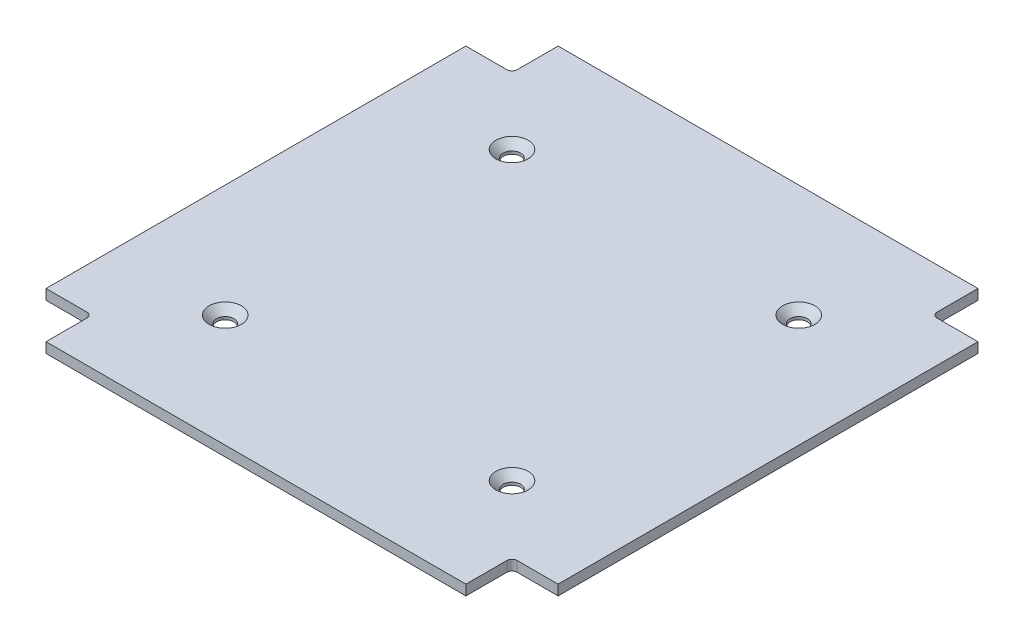
from build123d import *

# Parameters (mm, degrees)
SKETCH1_W                                      = 100
SKETCH1_H                                      = 100
BASE_EXTRUSION_DEPTH                           = 2
SKETCH2_W                                      = 9
SKETCH2_H                                      = 9
CORNER_CUTOUTS_DEPTH                           = 71.738956735
CSK_FOR_M3_FLAT_HEAD_MACHINE_SCREW2_AT_2_COUNT = 2
CSK_FOR_M3_FLAT_HEAD_MACHINE_SCREW2_AT_2_PITCH = 56
CSK_FOR_M3_FLAT_HEAD_MACHINE_SCREW2_AT_3_COUNT = 2
CSK_FOR_M3_FLAT_HEAD_MACHINE_SCREW2_AT_3_PITCH = 79.195959493
CSK_FOR_M3_FLAT_HEAD_MACHINE_SCREW2_AT_4_COUNT = 2
CSK_FOR_M3_FLAT_HEAD_MACHINE_SCREW2_AT_4_PITCH = 56
FILLET_FOR_RAILS_R                             = 1


with BuildPart() as part:
    # Sketch1 → Base Extrusion (new body)
    with BuildSketch(Plane(origin=(0, 0, 0), x_dir=(1, 0, 0), z_dir=(0, 1, 0))):
        Rectangle(SKETCH1_W, SKETCH1_H)
    extrude(amount=BASE_EXTRUSION_DEPTH)

    # Sketch2 → Corner Cutouts (cut, through all)
    with BuildSketch(Plane(origin=(0, 2, 0), x_dir=(1, 0, 0), z_dir=(0, 1, 0))):
        with Locations((45.5, 45.5)):
            Rectangle(SKETCH2_W, SKETCH2_H)
        with Locations((-45.5, 45.5)):
            Rectangle(SKETCH2_W, SKETCH2_H)
        with Locations((-45.5, -45.5)):
            Rectangle(SKETCH2_W, SKETCH2_H)
        with Locations((45.5, -45.5)):
            Rectangle(SKETCH2_W, SKETCH2_H)
    extrude(amount=-CORNER_CUTOUTS_DEPTH, mode=Mode.SUBTRACT)

    # Sketch10 → CSK for M3 Flat Head Machine Screw2 (revolve, cut)
    with BuildSketch(Plane(origin=(-28, 2, 28), x_dir=(0, 0, 1), z_dir=(1, 0, 0))):
        Polygon((0, 0), (0, 2), (1.7, 2), (1.7, 1.45), (3.15, 0), align=None)
    csk_for_m3_flat_head_machine_screw2 = revolve(axis=Axis((-28, 8.35, 28), (0, -1, 0)), mode=Mode.SUBTRACT)

    # CSK for M3 Flat Head Machine Screw2 at 2: CSK for M3 Flat Head Machine Screw2 ×2
    with Locations(*[(0, 0, -i * CSK_FOR_M3_FLAT_HEAD_MACHINE_SCREW2_AT_2_PITCH) for i in range(1, CSK_FOR_M3_FLAT_HEAD_MACHINE_SCREW2_AT_2_COUNT)]):
        add(csk_for_m3_flat_head_machine_screw2, mode=Mode.SUBTRACT)

    # CSK for M3 Flat Head Machine Screw2 at 3: CSK for M3 Flat Head Machine Screw2 ×2
    with Locations(*[Vector(0.7071067811865476, 0, -0.7071067811865476) * (i * CSK_FOR_M3_FLAT_HEAD_MACHINE_SCREW2_AT_3_PITCH) for i in range(1, CSK_FOR_M3_FLAT_HEAD_MACHINE_SCREW2_AT_3_COUNT)]):
        add(csk_for_m3_flat_head_machine_screw2, mode=Mode.SUBTRACT)

    # CSK for M3 Flat Head Machine Screw2 at 4: CSK for M3 Flat Head Machine Screw2 ×2
    with Locations(*[(i * CSK_FOR_M3_FLAT_HEAD_MACHINE_SCREW2_AT_4_PITCH, 0, 0) for i in range(1, CSK_FOR_M3_FLAT_HEAD_MACHINE_SCREW2_AT_4_COUNT)]):
        add(csk_for_m3_flat_head_machine_screw2, mode=Mode.SUBTRACT)

    # Fillet For Rails
    fillet_for_rails_edges = [part.edges().sort_by_distance(p)[0] for p in [
        (41, 1, -41),
        (-41, 1, -41),
        (-41, 1, 41),
        (41, 1, 41),
    ]]
    fillet(fillet_for_rails_edges, radius=FILLET_FOR_RAILS_R)


solid = part.part
